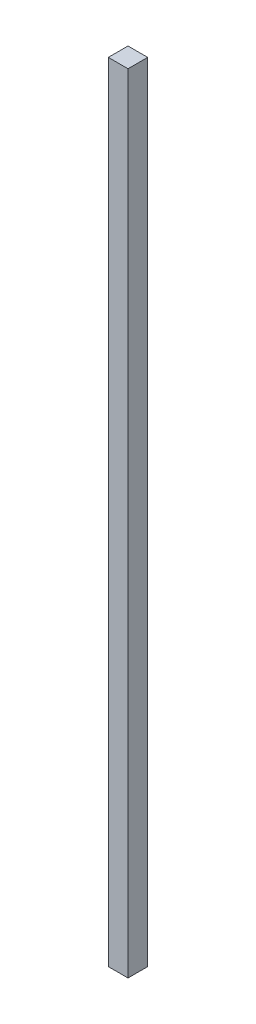
from build123d import *

# Parameters (mm, degrees)
SKETCH1_W           = 25
SKETCH1_H           = 25
BOSS_EXTRUDE1_DEPTH = 1000


with BuildPart() as part:
    # Sketch1 → Boss-Extrude1 (new body)
    with BuildSketch(Plane(origin=(0, 0, 0), x_dir=(1, 0, 0), z_dir=(0, 1, 0))):
        with Locations((-12.5, -12.5)):
            Rectangle(SKETCH1_W, SKETCH1_H)
    extrude(amount=BOSS_EXTRUDE1_DEPTH)


solid = part.part
